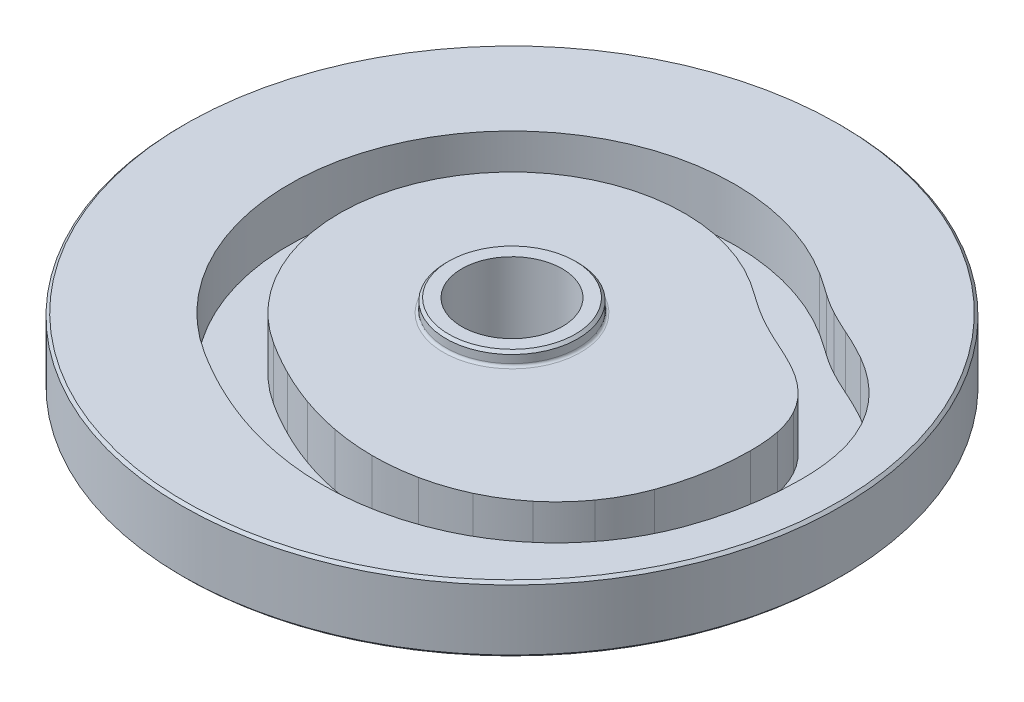
from build123d import *

# Parameters (mm, degrees)
CUT_EXTRUDE_THIN1_DEPTH      = 15
CUT_EXTRUDE_THIN1_DEPTH_BACK = 20


with BuildPart() as part:
    # Sketch1 → Base-Revolve (revolve)
    with BuildSketch(Plane.XY, mode=Mode.PRIVATE) as base_revolve_sk:
        with BuildLine():
            Line((19.05, 5), (24, 5))
            Line((24, 5), (25, 4))
            Line((25, 4), (25, 1))
            ThreePointArc((25, 1), (25.292893219, 0.292893219), (26, 0))
            Line((26, 0), (124, 0))
            Line((124, 0), (125, -1))
            Line((125, -1), (125, -24))
            Line((125, -24), (124, -25))
            Line((124, -25), (26, -25))
            ThreePointArc((26, -25), (25.292893219, -25.292893219), (25, -26))
            Line((25, -26), (25, -29))
            Line((25, -29), (24, -30))
            Line((24, -30), (19.05, -30))
            Line((19.05, -30), (19.05, 5))
        make_face()
    revolve(base_revolve_sk.sketch.rotate(Axis((0, -30350, 0), (0, 1, 0)), 90), axis=Axis((0, -30350, 0), (0, 1, 0)))

    # Sketch2 → Cut-Extrude-Thin1 (cut, two sides: drawn at the far end of the back side and taken through both)
    with BuildSketch(Plane(origin=(0, 0, 0), x_dir=(1, 0, 0), z_dir=(0, 1, 0)).offset(-CUT_EXTRUDE_THIN1_DEPTH_BACK)):
        with BuildLine():
            ThreePointArc((109.524986247, -0.054887133), (109.229921991, 7.423375501), (108.184717895, 14.834112532))
            ThreePointArc((108.184717895, 14.834112532), (106.043659804, 22.548927161), (102.756924095, 29.84960267))
            ThreePointArc((102.756924095, 29.84960267), (98.332860497, 36.567183371), (92.916011248, 42.513272287))
            ThreePointArc((92.916011248, 42.513272287), (87.141221214, 47.295885443), (80.843977188, 51.366058191))
            ThreePointArc((80.843977188, 51.366058191), (75.279655517, 54.316272842), (69.579158541, 56.993916655))
            ThreePointArc((69.579158541, 56.993916655), (65.230785476, 58.999236045), (60.953055197, 61.151137028))
            ThreePointArc((60.953055197, 61.151137028), (57.290135984, 63.276226982), (53.749285638, 65.599019115))
            ThreePointArc((53.749285638, 65.599019115), (49.601954473, 68.481518372), (45.406369026, 71.293318599))
            ThreePointArc((45.406369026, 71.293318599), (-71.312570217, 45.376127579), (-45.345877971, -71.331809006))
            ThreePointArc((-45.345877971, -71.331809006), (-38.593898018, -75.405527827), (-31.649923168, -79.142589722))
            ThreePointArc((-31.649923168, -79.142589722), (-24.034421899, -82.711545409), (-16.211151125, -85.798572893))
            ThreePointArc((-16.211151125, -85.798572893), (-7.620932162, -88.510877367), (1.153325471, -90.550696085))
            ThreePointArc((1.153325471, -90.550696085), (10.620649637, -91.921398106), (20.173660561, -92.420430343))
            ThreePointArc((20.173660561, -92.420430343), (30.195991067, -91.960061817), (40.115734041, -90.457481608))
            ThreePointArc((40.115734041, -90.457481608), (50.164053761, -87.778443627), (59.835395829, -83.955994636))
            ThreePointArc((59.835395829, -83.955994636), (69.217053614, -78.865285844), (77.888616734, -72.641556104))
            ThreePointArc((77.888616734, -72.641556104), (85.826699629, -65.22323814), (92.717665183, -56.823286045))
            ThreePointArc((92.717665183, -56.823286045), (98.476591418, -47.488521124), (102.919592608, -37.460420212))
            ThreePointArc((102.919592608, -37.460420212), (107.856238797, -19.046190631), (109.524986247, -0.054887133))
        make_face()
        with BuildLine():
            ThreePointArc((90.474982456, 0.056342792), (90.262741838, 5.647173284), (89.486847533, 11.187969228))
            ThreePointArc((89.486847533, 11.187969228), (88.12991005, 16.068178084), (86.054133631, 20.688661832))
            ThreePointArc((86.054133631, 20.688661832), (83.284958022, 24.885433828), (79.899946609, 28.603353472))
            ThreePointArc((79.899946609, 28.603353472), (75.875178075, 31.93428485), (71.488414915, 34.771567807))
            ThreePointArc((71.488414915, 34.771567807), (66.751022738, 37.282035549), (61.898062734, 39.56109503))
            ThreePointArc((61.898062734, 39.56109503), (56.897401317, 41.868517981), (51.979131099, 44.346709525))
            ThreePointArc((51.979131099, 44.346709525), (47.310945971, 47.049113929), (42.801511531, 50.008834013))
            ThreePointArc((42.801511531, 50.008834013), (38.952515201, 52.685804726), (35.059073926, 55.297712072))
            ThreePointArc((35.059073926, 55.297712072), (-55.279422123, 35.087905534), (-35.1167276, -55.261117141))
            ThreePointArc((-35.1167276, -55.261117141), (-29.160317457, -58.855298852), (-23.034341253, -62.152173057))
            ThreePointArc((-23.034341253, -62.152173057), (-16.494338073, -65.217270915), (-9.775872963, -67.868439157))
            ThreePointArc((-9.775872963, -67.868439157), (-2.592647115, -70.136469906), (4.744453336, -71.842240708))
            ThreePointArc((4.744453336, -71.842240708), (12.484550044, -72.962801762), (20.294689574, -73.370814789))
            ThreePointArc((20.294689574, -73.370814789), (28.32982468, -73.001688389), (36.282721862, -71.797081864))
            ThreePointArc((36.282721862, -71.797081864), (44.198795786, -69.686506265), (51.817937068, -66.675286938))
            ThreePointArc((51.817937068, -66.675286938), (59.100153222, -62.723698973), (65.831324035, -57.892854425))
            ThreePointArc((65.831324035, -57.892854425), (71.928664779, -52.194534162), (77.221947559, -45.742435637))
            ThreePointArc((77.221947559, -45.742435637), (81.623193338, -38.607897611), (85.018936267, -30.943595477))
            ThreePointArc((85.018936267, -30.943595477), (89.105431486, -15.682719937), (90.474982456, 0.056342792))
        make_face(mode=Mode.SUBTRACT)
    extrude(amount=CUT_EXTRUDE_THIN1_DEPTH + CUT_EXTRUDE_THIN1_DEPTH_BACK, mode=Mode.SUBTRACT)


solid = part.part
